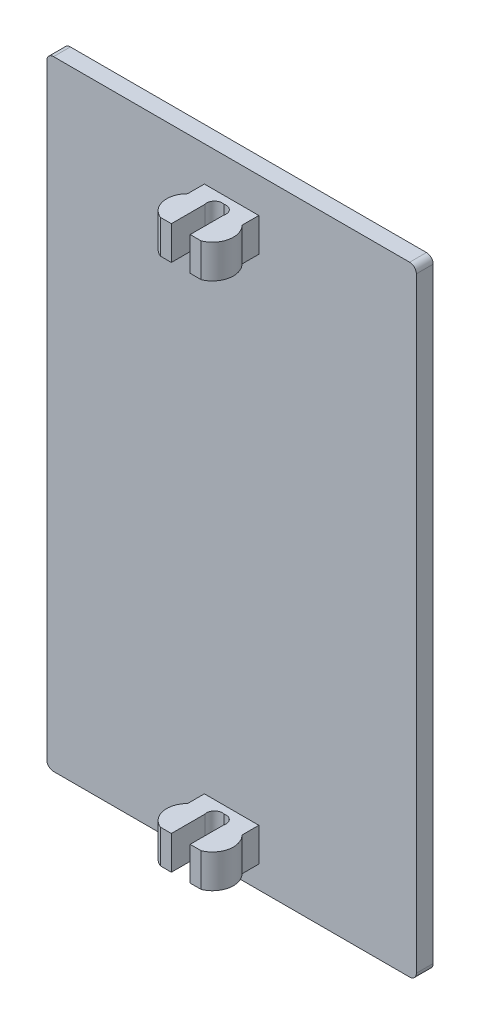
from build123d import *

# Parameters (mm, degrees)
SKETCH1_W           = 55
SKETCH1_H           = 92.14389058
BOSS_EXTRUDE1_DEPTH = 2.5
BOSS_EXTRUDE2_DEPTH = 2.5
BOSS_EXTRUDE3_DEPTH = 2.5
FILLET1_R           = 1


with BuildPart() as part:
    # Sketch1 → Boss-Extrude1 (new body)
    with BuildSketch(Plane.XY):
        Rectangle(SKETCH1_W, SKETCH1_H)
    extrude(amount=BOSS_EXTRUDE1_DEPTH)

    # Sketch6 → Boss-Extrude2 (add, symmetric)
    with BuildSketch(Plane(origin=(0, 38.37194529, 0), x_dir=(1, 0, 0), z_dir=(0, 1, 0))):
        with BuildLine():
            Line((-4.053033857, -5), (-4.053033857, -2.5))
            Line((-4.053033857, -2.5), (4.053033857, -2.5))
            Line((4.053033857, -2.5), (4.053033857, -5))
            ThreePointArc((4.053033857, -5), (4.899562702, -7.805363596), (3.036123017, -10.066838454))
            Line((3.036123017, -10.066838454), (1.4, -10.066838454))
            Line((1.4, -10.066838454), (1.4, -5.066838454))
            ThreePointArc((1.4, -5.066838454), (1.111291087, -3.950394141), (0, -3.642444699))
            ThreePointArc((0, -3.642444699), (-1.111291087, -3.950394141), (-1.4, -5.066838454))
            Line((-1.4, -5.066838454), (-1.4, -10.066838454))
            Line((-1.4, -10.066838454), (-3.036123017, -10.066838454))
            ThreePointArc((-3.036123017, -10.066838454), (-4.899562702, -7.805363596), (-4.053033857, -5))
        make_face()
    extrude(amount=BOSS_EXTRUDE2_DEPTH, both=True)

    # Sketch7 → Boss-Extrude3 (add, symmetric)
    with BuildSketch(Plane(origin=(0, -40.22805471, 0), x_dir=(-1, 0, 0), z_dir=(0, -1, 0))):
        with BuildLine():
            Line((-4.053033857, -5), (-4.053033857, -2.5))
            Line((-4.053033857, -2.5), (4.053033857, -2.5))
            Line((4.053033857, -2.5), (4.053033857, -5))
            ThreePointArc((4.053033857, -5), (4.899562702, -7.805363596), (3.036123017, -10.066838454))
            Line((3.036123017, -10.066838454), (1.4, -10.066838454))
            Line((1.4, -10.066838454), (1.4, -5.066838454))
            ThreePointArc((1.4, -5.066838454), (1.111291087, -3.950394141), (0, -3.642444699))
            ThreePointArc((0, -3.642444699), (-1.111291087, -3.950394141), (-1.4, -5.066838454))
            Line((-1.4, -5.066838454), (-1.4, -10.066838454))
            Line((-1.4, -10.066838454), (-3.036123017, -10.066838454))
            ThreePointArc((-3.036123017, -10.066838454), (-4.899562702, -7.805363596), (-4.053033857, -5))
        make_face()
    extrude(amount=BOSS_EXTRUDE3_DEPTH, both=True)

    # Fillet1
    fillet1_edges = [part.edges().sort_by_distance(p)[0] for p in [
        (-27.5, 46.07194529, 1.25),
        (27.5, 46.07194529, 1.25),
        (27.5, -46.07194529, 1.25),
        (-27.5, -46.07194529, 1.25),
    ]]
    fillet(fillet1_edges, radius=FILLET1_R)


solid = part.part
